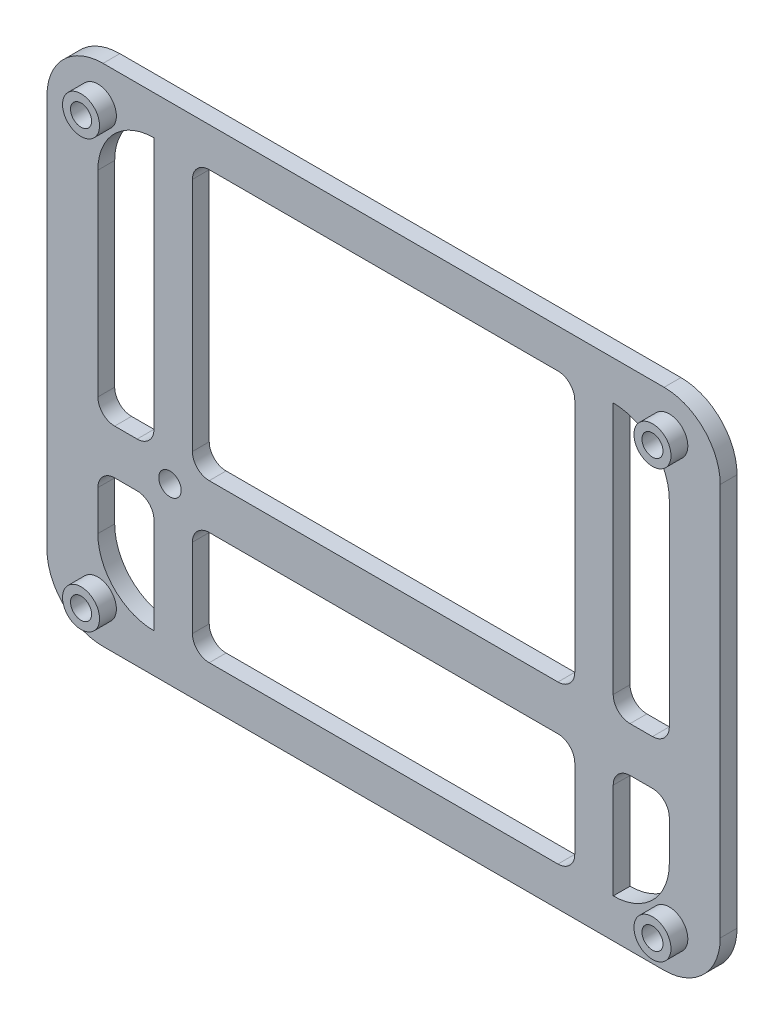
from build123d import *

# Parameters (mm, degrees)
IZIM1_R                     = 1.875
IZIM1_R_2                   = 2
Y_KSEKLIK_EKSTR_ZYON2_DEPTH = 3
KES_EKSTR_ZYON1_DEPTH       = 2.4
IZIM3_R                     = 3.3
IZIM3_R_2                   = 1.875
Y_KSEKLIK_EKSTR_ZYON3_DEPTH = 3


with BuildPart() as part:
    # Çizim1 → Yükseklik-Ekstrüzyon2 (new body)
    with BuildSketch(Plane.XY):
        with BuildLine():
            Line((-50, 45), (50, 45))
            ThreePointArc((50, 45), (57.071067812, 42.071067812), (60, 35))
            Line((60, 35), (60, -35))
            ThreePointArc((60, -35), (57.071067812, -42.071067812), (50, -45))
            Line((50, -45), (-50, -45))
            ThreePointArc((-50, -45), (-57.071067812, -42.071067812), (-60, -35))
            Line((-60, -35), (-60, 35))
            ThreePointArc((-60, 35), (-57.071067812, 42.071067812), (-50, 45))
        make_face()
        with Locations((-50.925, 38.05)):
            Circle(IZIM1_R, mode=Mode.SUBTRACT)
        with Locations((50.925, 38.05)):
            Circle(IZIM1_R, mode=Mode.SUBTRACT)
        with Locations((-50.925, -38.05)):
            Circle(IZIM1_R, mode=Mode.SUBTRACT)
        with Locations((50.925, -38.05)):
            Circle(IZIM1_R, mode=Mode.SUBTRACT)
        with Locations((-38.075, -13.95)):
            Circle(IZIM1_R_2, mode=Mode.SUBTRACT)
        with BuildLine():
            Line((-31.075, -38.05), (31.075, -38.05))
            ThreePointArc((31.075, -38.05), (33.196320344, -37.171320344), (34.075, -35.05))
            Line((34.075, -35.05), (34.075, -20.95))
            ThreePointArc((34.075, -20.95), (33.196320344, -18.828679656), (31.075, -17.95))
            Line((31.075, -17.95), (-31.075, -17.95))
            ThreePointArc((-31.075, -17.95), (-33.196320344, -18.828679656), (-34.075, -20.95))
            Line((-34.075, -20.95), (-34.075, -35.05))
            ThreePointArc((-34.075, -35.05), (-33.196320344, -37.171320344), (-31.075, -38.05))
        make_face(mode=Mode.SUBTRACT)
        with BuildLine():
            Line((50.925, 28.05), (50.925, -6.95))
            ThreePointArc((50.925, -6.95), (50.046320344, -9.071320344), (47.925, -9.95))
            Line((47.925, -9.95), (43.925, -9.95))
            ThreePointArc((43.925, -9.95), (41.803679656, -9.071320344), (40.925, -6.95))
            Line((40.925, -6.95), (40.925, 38.05))
            ThreePointArc((40.925, 38.05), (47.996067812, 35.121067812), (50.925, 28.05))
        make_face(mode=Mode.SUBTRACT)
        with BuildLine():
            Line((-31.075, 38.05), (31.075, 38.05))
            ThreePointArc((31.075, 38.05), (33.196320344, 37.171320344), (34.075, 35.05))
            Line((34.075, 35.05), (34.075, -6.95))
            ThreePointArc((34.075, -6.95), (33.196320344, -9.071320344), (31.075, -9.95))
            Line((31.075, -9.95), (-31.075, -9.95))
            ThreePointArc((-31.075, -9.95), (-33.196320344, -9.071320344), (-34.075, -6.95))
            Line((-34.075, -6.95), (-34.075, 35.05))
            ThreePointArc((-34.075, 35.05), (-33.196320344, 37.171320344), (-31.075, 38.05))
        make_face(mode=Mode.SUBTRACT)
        with BuildLine():
            Line((-50.925, 28.05), (-50.925, -6.95))
            ThreePointArc((-50.925, -6.95), (-50.046320344, -9.071320344), (-47.925, -9.95))
            Line((-47.925, -9.95), (-43.925, -9.95))
            ThreePointArc((-43.925, -9.95), (-41.803679656, -9.071320344), (-40.925, -6.95))
            Line((-40.925, -6.95), (-40.925, 38.05))
            ThreePointArc((-40.925, 38.05), (-47.996067812, 35.121067812), (-50.925, 28.05))
        make_face(mode=Mode.SUBTRACT)
        with BuildLine():
            Line((-47.925, -17.95), (-43.925, -17.95))
            ThreePointArc((-43.925, -17.95), (-41.803679656, -18.828679656), (-40.925, -20.95))
            Line((-40.925, -20.95), (-40.925, -38.05))
            ThreePointArc((-40.925, -38.05), (-47.996067812, -35.121067812), (-50.925, -28.05))
            Line((-50.925, -28.05), (-50.925, -20.95))
            ThreePointArc((-50.925, -20.95), (-50.046320344, -18.828679656), (-47.925, -17.95))
        make_face(mode=Mode.SUBTRACT)
        with BuildLine():
            Line((50.925, -20.95), (50.925, -28.05))
            ThreePointArc((50.925, -28.05), (47.996067812, -35.121067812), (40.925, -38.05))
            Line((40.925, -38.05), (40.925, -20.95))
            ThreePointArc((40.925, -20.95), (41.803679656, -18.828679656), (43.925, -17.95))
            Line((43.925, -17.95), (47.925, -17.95))
            ThreePointArc((47.925, -17.95), (50.046320344, -18.828679656), (50.925, -20.95))
        make_face(mode=Mode.SUBTRACT)
    extrude(amount=Y_KSEKLIK_EKSTR_ZYON2_DEPTH)

    # Çizim2 → Kes-Ekstrüzyon1 (cut)
    with BuildSketch(Plane(origin=(0, 0, 0), x_dir=(-1, 0, 0), z_dir=(0, 0, -1))):
        Polygon((-53.35905554, -36.010709201), (-53.908105407, -39.138308533), (-51.474049867, -41.177599331), (-48.49094446, -40.089290799), (-47.941894593, -36.961691467), (-50.375950133, -34.922400669), align=None)
        Polygon((48.49094446, -36.010709201), (47.941894593, -39.138308533), (50.375950133, -41.177599331), (53.35905554, -40.089290799), (53.908105407, -36.961691467), (51.474049867, -34.922400669), align=None)
        Polygon((48.49094446, 40.089290799), (47.941894593, 36.961691467), (50.375950133, 34.922400669), (53.35905554, 36.010709201), (53.908105407, 39.138308533), (51.474049867, 41.177599331), align=None)
        Polygon((-53.35905554, 40.089290799), (-53.908105407, 36.961691467), (-51.474049867, 34.922400669), (-48.49094446, 36.010709201), (-47.941894593, 39.138308533), (-50.375950133, 41.177599331), align=None)
    extrude(amount=-KES_EKSTR_ZYON1_DEPTH, mode=Mode.SUBTRACT)

    # Çizim3 → Yükseklik-Ekstrüzyon3 (add)
    # profile 1 of 4: a face of its own
    with BuildSketch(Plane.XY.offset(3)):
        with Locations((-50.925, 38.05)):
            Circle(IZIM3_R)
        with Locations(Location((-50.925, 38.05, 0), (0, 0, 180))):
            Circle(IZIM3_R_2, mode=Mode.SUBTRACT)
    # profile 2 of 4: a face of its own
    with BuildSketch(Plane.XY.offset(3)):
        with Locations((50.925, 38.05)):
            Circle(IZIM3_R)
        with Locations(Location((50.925, 38.05, 0), (0, 0, 180))):
            Circle(IZIM3_R_2, mode=Mode.SUBTRACT)
    # profile 3 of 4: a face of its own
    with BuildSketch(Plane.XY.offset(3)):
        with Locations((-50.925, -38.05)):
            Circle(IZIM3_R)
        with Locations(Location((-50.925, -38.05, 0), (0, 0, 180))):
            Circle(IZIM3_R_2, mode=Mode.SUBTRACT)
    # profile 4 of 4: a face of its own
    with BuildSketch(Plane.XY.offset(3)):
        with Locations((50.925, -38.05)):
            Circle(IZIM3_R)
        with Locations(Location((50.925, -38.05, 0), (0, 0, 180))):
            Circle(IZIM3_R_2, mode=Mode.SUBTRACT)
    extrude(amount=Y_KSEKLIK_EKSTR_ZYON3_DEPTH)


solid = part.part
